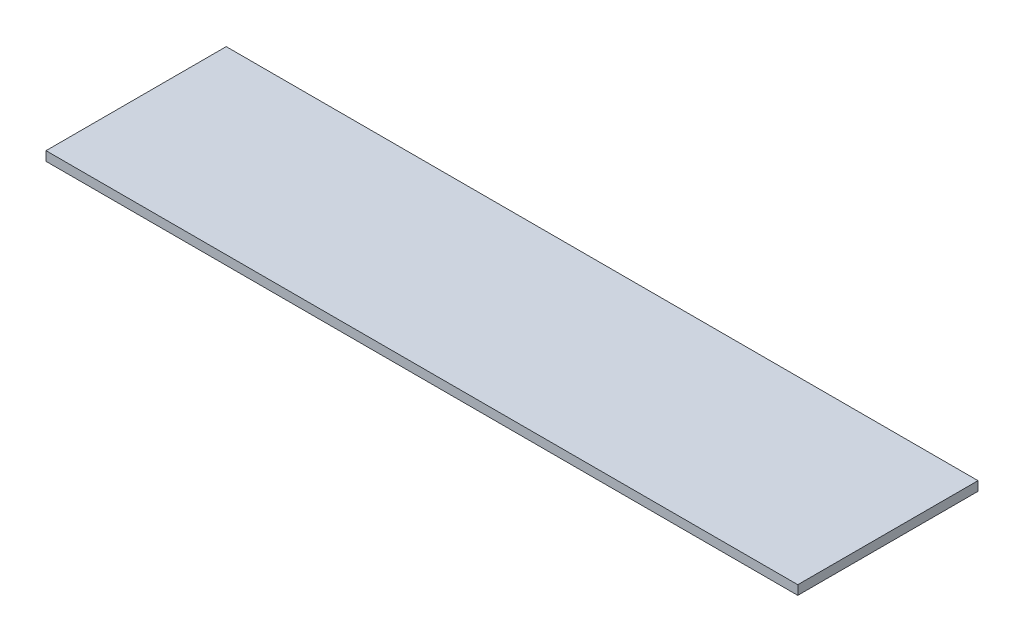
from build123d import *

# Parameters (mm, degrees)
SKETCH1_W           = 1460
SKETCH1_H           = 350
BOSS_EXTRUDE1_DEPTH = 18


with BuildPart() as part:
    # Sketch1 → Boss-Extrude1 (new body)
    with BuildSketch(Plane(origin=(0, 0, 0), x_dir=(1, 0, 0), z_dir=(0, 1, 0))):
        Rectangle(SKETCH1_W, SKETCH1_H)
    extrude(amount=BOSS_EXTRUDE1_DEPTH)


solid = part.part
